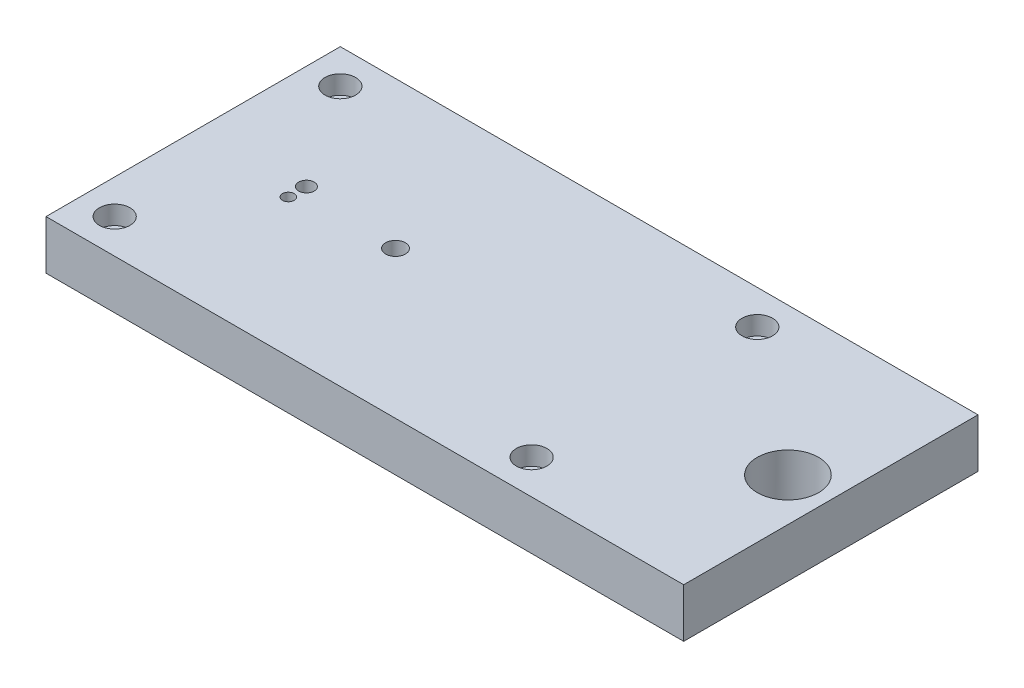
from build123d import *

# Parameters (mm, degrees)
SKETCH1_W           = 165.1
SKETCH1_H           = 76.2
BOSS_EXTRUDE1_DEPTH = 12.7
SKETCH2_R           = 3.9624
SKETCH2_R_2         = 2.5527
CUT_EXTRUDE3_DEPTH  = 4.826
SKETCH10_R          = 2.5527
CUT_EXTRUDE9_DEPTH  = 22.352
SKETCH11_R          = 7.9375
SKETCH11_R_2        = 2.5527
SKETCH11_R_3        = 2.0193
SKETCH11_R_4        = 1.524
CUT_EXTRUDE10_DEPTH = 22.352


with BuildPart() as part:
    # Sketch1 → Boss-Extrude1 (new body)
    with BuildSketch(Plane(origin=(0, 0, 0), x_dir=(1, 0, 0), z_dir=(0, 1, 0))):
        with Locations((17.306400742, -14.73812616)):
            Rectangle(SKETCH1_W, SKETCH1_H)
    extrude(amount=BOSS_EXTRUDE1_DEPTH)

    # Sketch2 → Cut-Extrude3 (cut)
    # profile 1 of 4: a face of its own
    with BuildSketch(Plane(origin=(0, 12.7, 0), x_dir=(1, 0, 0), z_dir=(0, 1, 0))):
        with Locations(Location((-56.353599258, -43.94812616, 0), (0, 0, 270))):
            Circle(SKETCH2_R)
        with Locations(Location((-56.353599258, -43.94812616, 0), (0, 0, 270))):
            Circle(SKETCH2_R_2, mode=Mode.SUBTRACT)
    # profile 2 of 4: a face of its own
    with BuildSketch(Plane(origin=(0, 12.7, 0), x_dir=(1, 0, 0), z_dir=(0, 1, 0))):
        with Locations(Location((-56.353599258, 14.47187384, 0), (0, 0, 270))):
            Circle(SKETCH2_R)
        with Locations(Location((-56.353599258, 14.47187384, 0), (0, 0, 270))):
            Circle(SKETCH2_R_2, mode=Mode.SUBTRACT)
    # profile 3 of 4: a face of its own
    with BuildSketch(Plane(origin=(0, 12.7, 0), x_dir=(1, 0, 0), z_dir=(0, 1, 0))):
        with Locations(Location((51.596400742, 14.47187384, 0), (0, 0, 270))):
            Circle(SKETCH2_R)
        with Locations(Location((51.596400742, 14.47187384, 0), (0, 0, 270))):
            Circle(SKETCH2_R_2, mode=Mode.SUBTRACT)
    # profile 4 of 4: a face of its own
    with BuildSketch(Plane(origin=(0, 12.7, 0), x_dir=(1, 0, 0), z_dir=(0, 1, 0))):
        with Locations(Location((51.596400742, -43.94812616, 0), (0, 0, 270))):
            Circle(SKETCH2_R)
        with Locations(Location((51.596400742, -43.94812616, 0), (0, 0, 270))):
            Circle(SKETCH2_R_2, mode=Mode.SUBTRACT)
    extrude(amount=-CUT_EXTRUDE3_DEPTH, mode=Mode.SUBTRACT)

    # Sketch10 → Cut-Extrude9 (cut)
    with BuildSketch(Plane(origin=(0, 12.7, 0), x_dir=(1, 0, 0), z_dir=(0, 1, 0))):
        with Locations(Location((-56.353599258, -43.94812616, 0), (0, 0, 270))):
            Circle(SKETCH10_R)
        with Locations(Location((-56.353599258, 14.47187384, 0), (0, 0, 270))):
            Circle(SKETCH10_R)
        with Locations(Location((51.596400742, 14.47187384, 0), (0, 0, 270))):
            Circle(SKETCH10_R)
        with Locations(Location((51.596400742, -43.94812616, 0), (0, 0, 270))):
            Circle(SKETCH10_R)
    extrude(amount=-CUT_EXTRUDE9_DEPTH, mode=Mode.SUBTRACT)

    # Sketch11 → Cut-Extrude10 (cut)
    with BuildSketch(Plane(origin=(0, 12.7, 0), x_dir=(1, 0, 0), z_dir=(0, 1, 0))):
        with Locations(Location((88.743900742, -14.73812616, 0), (0, 0, 270))):
            Circle(SKETCH11_R)
        with Locations(Location((-12.856099258, -14.73812616, 0), (0, 0, 270))):
            Circle(SKETCH11_R_2)
        with Locations(Location((-38.256099258, -12.40132616, 0), (0, 0, 270))):
            Circle(SKETCH11_R_3)
        with Locations(Location((-38.256099258, -17.07492616, 0), (0, 0, 270))):
            Circle(SKETCH11_R_4)
    extrude(amount=-CUT_EXTRUDE10_DEPTH, mode=Mode.SUBTRACT)


solid = part.part
